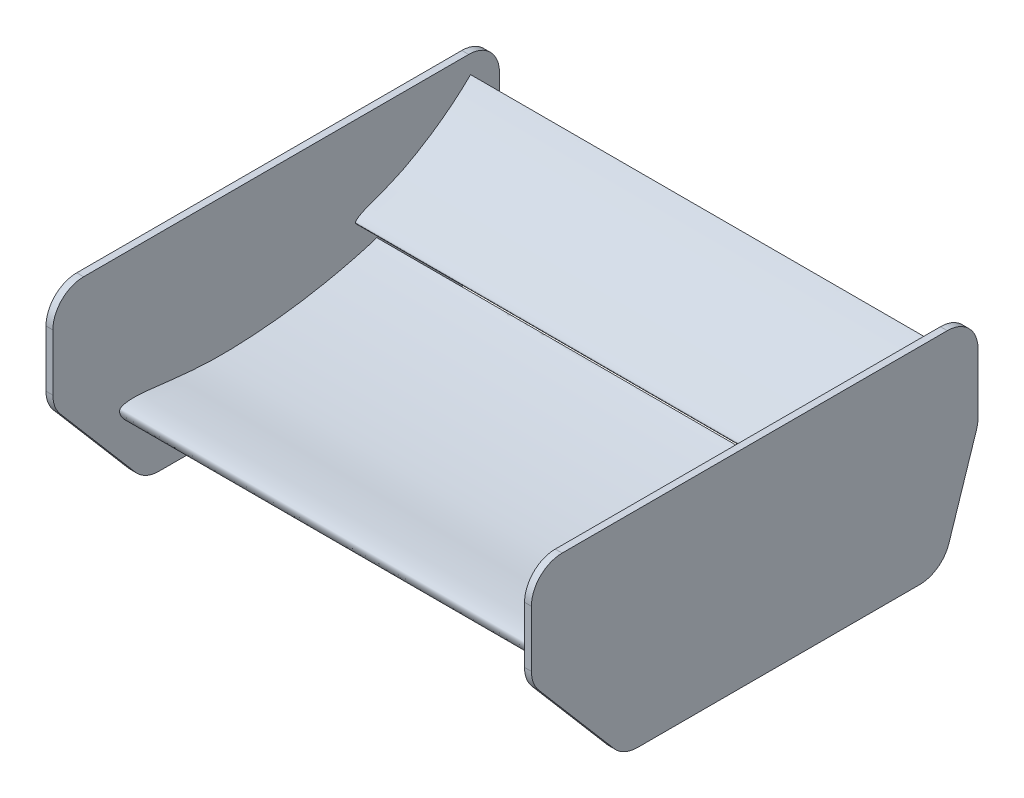
from build123d import *

# Parameters (mm, degrees)
EXTRUDED_AIRFOILS_DEPTH   = 487.449999952
EXTRUDED_AIRFOILS_2_DEPTH = 487.449999952
EXTRUDED_ENDPLATE_DEPTH   = 14.200000048


with BuildPart() as part:
    # Airfoils Sketch → Extruded Airfoils (new body)
    with BuildSketch(Plane(origin=(0, 0, 0), x_dir=(0, 0, -1), z_dir=(1, 0, 0))):
        with BuildLine():
            add(Edge.make_bspline(
                [(939.324017067, 941.688873228), (939.339054759, 941.641844124), (935.676703076, 939.71633403), (932.384753578, 937.363798459), (924.887186095, 932.328637555), (916.209983634, 926.570937112), (904.921254311, 920.249689794), (891.416070731, 913.715551821), (875.677464007, 906.643284454), (857.939094471, 899.080924626), (838.451534022, 891.127800668), (817.507453735, 882.912333828), (795.392079351, 874.604571074), (772.401865797, 866.368085397), (748.823162057, 858.397918888), (724.928449568, 850.915307643), (700.989738319, 844.11129411), (677.184512134, 838.243674908), (653.585449014, 833.656987043), (630.278164333, 830.403451289), (607.349161865, 828.463904943), (584.926560941, 827.796453281), (563.145876611, 828.350450864), (542.167589646, 830.052059024), (522.158562976, 832.757498791), (503.304073163, 836.369991933), (485.786519637, 840.806471412), (469.764954344, 845.961461501), (455.382043258, 851.727453903), (442.753920134, 857.982519587), (431.981552712, 864.594650115), (423.132675266, 871.411144709), (416.253917386, 878.254816043), (411.376001011, 884.946014913), (408.686513934, 890.840217454), (407.859927919, 894.99914973), (407.911585164, 897.226493948), (408.050985267, 898.323866061), (408.23743942, 899.045054044), (408.417771906, 899.584396667), (408.587304258, 899.955317564), (408.784556326, 900.303921915), (409.042207288, 900.619525567), (409.339677062, 900.920330889), (409.794744252, 901.335782492), (410.474599823, 901.817379858), (411.573177097, 902.472936633), (412.940662315, 903.120412889), (416.573283921, 904.537907439), (423.446279524, 905.907425374), (434.436838855, 906.716452006), (448.372098591, 906.464643697), (465.326083714, 905.166410991), (485.46635869, 902.814843604), (508.889722171, 899.764079767), (535.545476386, 896.725674669), (565.080468494, 894.154989371), (596.917735088, 892.457931293), (630.291363415, 892.158734804), (664.32935029, 893.30383389), (698.294192738, 895.504846357), (731.632596348, 898.583575279), (763.84356687, 902.448226735), (794.390431601, 907.047529035), (822.769468065, 912.150284383), (848.573928873, 917.41646019), (871.5217613, 922.60415958), (891.294887224, 927.47431108), (907.955315664, 931.908701062), (920.691607319, 935.460998869), (930.971572408, 938.763985021), (935.252865294, 940.050693316), (939.308743067, 941.736641366), (939.324017067, 941.688873228)],
                knots=[0, 0, 0, 0, 0.001812691, 0.006911328, 0.014576348, 0.024172143, 0.035572242, 0.04901308, 0.064512615, 0.081849281, 0.100772139, 0.120997345, 0.142228397, 0.164173399, 0.186536734, 0.209022727, 0.231367049, 0.253319655, 0.274803883, 0.295858285, 0.316448578, 0.336530716, 0.35603337, 0.374893008, 0.392989986, 0.410197087, 0.426388181, 0.441458696, 0.455334222, 0.467938119, 0.479235883, 0.48920359, 0.497850586, 0.505193934, 0.511308341, 0.515097163, 0.516441428, 0.517272652, 0.518060388, 0.518436362, 0.518797413, 0.519153544, 0.519507976, 0.519886846, 0.520288641, 0.521160208, 0.522116283, 0.523720315, 0.52521352, 0.532574604, 0.542380648, 0.554776211, 0.56993128, 0.588004893, 0.609187965, 0.63332852, 0.660001247, 0.688743434, 0.718873444, 0.749542513, 0.780126844, 0.81020899, 0.839387288, 0.867183376, 0.893104481, 0.916760447, 0.937874173, 0.956198632, 0.971543675, 0.983762849, 0.992691516, 0.998158824, 1, 1, 1, 1], degree=3))
        make_face()
    extrude(amount=EXTRUDED_AIRFOILS_DEPTH)



with BuildPart() as body_2:
    # Airfoils Sketch → Extruded Airfoils 2 (new body)
    with BuildSketch(Plane(origin=(0, 0, 0), x_dir=(0, 0, -1), z_dir=(1, 0, 0))):
        with BuildLine():
            add(Edge.make_bspline(
                [(1133.247895197, 1136.500000046), (1133.266097288, 1136.481626762), (1132.014707979, 1134.712033229), (1131.037740528, 1132.83122267), (1128.735877213, 1128.698268296), (1126.055280559, 1123.947569365), (1122.289852096, 1118.312820167), (1117.540591559, 1112.051628231), (1111.876922519, 1105.008163599), (1105.396474988, 1097.260411449), (1098.19257458, 1088.914317208), (1090.371276907, 1080.099415859), (1082.025263933, 1070.962899311), (1073.253998018, 1061.651608303), (1064.144741405, 1052.324667523), (1054.772055056, 1043.150129098), (1045.217460085, 1034.281841134), (1035.502486126, 1025.882328337), (1025.579120822, 1018.129675385), (1015.474904047, 1011.068614364), (1005.234765621, 1004.710772693), (994.92846386, 999.067064719), (984.631289752, 994.146079418), (974.435701685, 989.951518032), (964.453768836, 986.455957133), (954.794977359, 983.658288217), (945.564210018, 981.56311784), (936.860781778, 980.159041889), (928.776843338, 979.429810957), (921.395591654, 979.346135741), (914.795542365, 979.870416154), (909.044621195, 980.947491558), (904.206726953, 982.505754219), (900.338919507, 984.468664491), (897.682020108, 986.580020905), (896.307224773, 988.324502312), (895.80166154, 989.376327617), (895.605761957, 989.921640587), (895.521281629, 990.302571432), (895.477187864, 990.597176067), (895.468104939, 990.81060698), (895.477266271, 991.020214242), (895.522464552, 991.228782623), (895.589766089, 991.439913457), (895.703357722, 991.742029123), (895.906132309, 992.128471885), (896.262963388, 992.695678509), (896.74722015, 993.323061344), (898.105542313, 994.848485082), (900.987613441, 997.122092956), (905.924711837, 1000.113284995), (912.488425414, 1003.309629736), (920.709876051, 1006.735456309), (930.668912347, 1010.427387156), (942.326496265, 1014.573724019), (955.489755197, 1019.494506139), (969.88557953, 1025.318277234), (985.148163597, 1032.097276961), (1000.795377042, 1039.894037245), (1016.409198326, 1048.522863327), (1031.737780807, 1057.627108799), (1046.565268228, 1066.992030074), (1060.679666716, 1076.455646594), (1073.842694259, 1085.866405744), (1085.874234549, 1094.996615924), (1096.665312673, 1103.590851526), (1106.14181381, 1111.469141576), (1114.212137551, 1118.444266761), (1120.933336343, 1124.475800714), (1126.032836559, 1129.162469061), (1130.045213126, 1133.148653618), (1131.737383225, 1134.767294075), (1133.22940707, 1136.518662055), (1133.247895197, 1136.500000046)],
                knots=[0, 0, 0, 0, 0.001812691, 0.006911328, 0.014576348, 0.024172143, 0.035572242, 0.04901308, 0.064512615, 0.081849281, 0.100772139, 0.120997345, 0.142228397, 0.164173399, 0.186536734, 0.209022727, 0.231367049, 0.253319655, 0.274803883, 0.295858285, 0.316448578, 0.336530716, 0.35603337, 0.374893008, 0.392989986, 0.410197087, 0.426388181, 0.441458696, 0.455334222, 0.467938119, 0.479235883, 0.48920359, 0.497850586, 0.505193934, 0.511308341, 0.515097163, 0.516441428, 0.517272652, 0.518060388, 0.518436362, 0.518797413, 0.519153544, 0.519507976, 0.519886846, 0.520288641, 0.521160208, 0.522116283, 0.523720315, 0.52521352, 0.532574604, 0.542380648, 0.554776211, 0.56993128, 0.588004893, 0.609187965, 0.63332852, 0.660001247, 0.688743434, 0.718873444, 0.749542513, 0.780126844, 0.81020899, 0.839387288, 0.867183376, 0.893104481, 0.916760447, 0.937874173, 0.956198632, 0.971543675, 0.983762849, 0.992691516, 0.998158824, 1, 1, 1, 1], degree=3))
        make_face()
    extrude(amount=EXTRUDED_AIRFOILS_2_DEPTH)


with BuildPart() as part_1:
    add(part.part)

    add(body_2.part)  # Extruded Endplate merges body 2
    # Endplate Sketch → Extruded Endplate (add)
    with BuildSketch(Plane(origin=(501.65, 0, 0), x_dir=(0, 0, -1), z_dir=(1, 0, 0))):
        with BuildLine():
            Line((333.44768579, 1174.600000046), (1129.475, 1174.600000046))
            ThreePointArc((1129.475, 1174.600000046), (1174.376280605, 1156.001280651), (1192.975, 1111.100000046))
            Line((1192.975, 1111.100000046), (1192.975, 986.671665425))
            ThreePointArc((1192.975, 986.671665425), (1192.187961727, 976.704999408), (1189.846356489, 966.985393159))
            Line((1189.846356489, 966.985393159), (1132.89690026, 792.340042461))
            ThreePointArc((1132.89690026, 792.340042461), (1109.822807151, 760.634057096), (1072.525543772, 748.526314727))
            Line((1072.525543772, 748.526314727), (489.177152122, 748.526314727))
            ThreePointArc((489.177152122, 748.526314727), (462.584654451, 754.362729445), (440.880498348, 770.799099999))
            Line((440.880498348, 770.799099999), (285.151032016, 953.232285636))
            ThreePointArc((285.151032016, 953.232285636), (273.869638177, 972.488923615), (269.94768579, 994.459500364))
            Line((269.94768579, 994.459500364), (269.94768579, 1111.100000046))
            ThreePointArc((269.94768579, 1111.100000046), (288.546405185, 1156.001280651), (333.44768579, 1174.600000046))
        make_face()
    extrude(amount=-EXTRUDED_ENDPLATE_DEPTH)

    # Mirror 2: part across plane


with BuildPart() as part_2:
    add(part_1.part)
    add(part_1.part.mirror(Plane(origin=(0, 0, 0), x_dir=(0, 0, 1), z_dir=(1, 0, 0))))


solid = part_2.part
